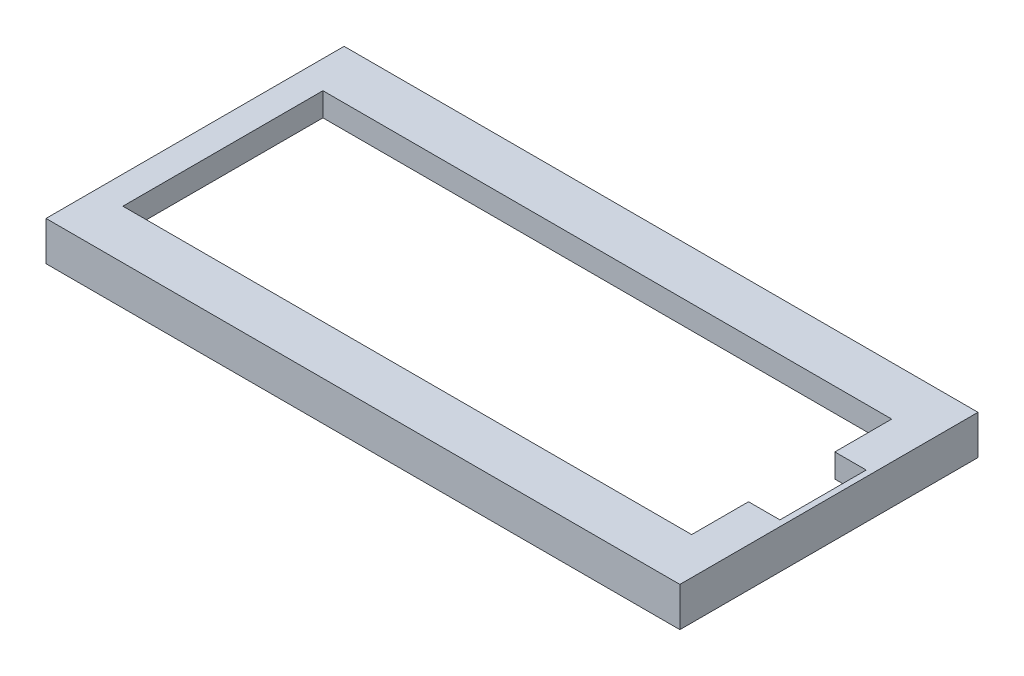
from build123d import *

# Parameters (mm, degrees)
SKETCH1_W           = 82
SKETCH1_H           = 38
MAIN_DEPTH          = 3
SKETCH2_W           = 72.5
SKETCH2_H           = 25.5
LCD_CUTOUT_DEPTH    = 46.287967497
SKETCH3_W           = 41
SKETCH3_H           = 4.75
CONNECTOR_CUT_DEPTH = 1.5
SKETCH4_W           = 9.33307462
SKETCH4_H           = 11
CUT_EXTRUDE3_DEPTH  = 46.287967497
SKETCH6_W           = 82
SKETCH6_H           = 38
BOSS_EXTRUDE2_DEPTH = 2
SKETCH7_W           = 80.5
SKETCH7_H           = 36.5
CUT_EXTRUDE6_DEPTH  = 46.287967497
SKETCH8_W           = 41
SKETCH8_H           = 4.75
CUT_EXTRUDE7_DEPTH  = 46.323834789
SKETCH9_W           = 0.75
SKETCH9_H           = 11
BOSS_EXTRUDE3_DEPTH = 3
SKETCH10_W          = 38
SKETCH10_H          = 5
CUT_EXTRUDE8_DEPTH  = 1.2


with BuildPart() as part:
    # Sketch1 → main (new body)
    with BuildSketch(Plane(origin=(0, 0, 0), x_dir=(1, 0, 0), z_dir=(0, 1, 0))):
        Rectangle(SKETCH1_W, SKETCH1_H)
    extrude(amount=MAIN_DEPTH)

    # Sketch2 → LCD cutout (cut, through all)
    with BuildSketch(Plane(origin=(0, 3, 0), x_dir=(1, 0, 0), z_dir=(0, 1, 0))):
        Rectangle(SKETCH2_W, SKETCH2_H)
    extrude(amount=-LCD_CUTOUT_DEPTH, mode=Mode.SUBTRACT)

    # Sketch3 → connector cut (cut)
    with BuildSketch(Plane.XZ):
        with Locations((-14.5, -16.625)):
            Rectangle(SKETCH3_W, SKETCH3_H)
    extrude(amount=-CONNECTOR_CUT_DEPTH, mode=Mode.SUBTRACT)

    # Sketch4 → Cut-Extrude3 (cut, through all)
    with BuildSketch(Plane(origin=(0, 3, 0), x_dir=(1, 0, 0), z_dir=(0, 1, 0))):
        with Locations((36.888390736, 0)):
            Rectangle(SKETCH4_W, SKETCH4_H)
    extrude(amount=-CUT_EXTRUDE3_DEPTH, mode=Mode.SUBTRACT)

    # Sketch6 → Boss-Extrude2 (add)
    with BuildSketch(Plane(origin=(0, 0, 0), x_dir=(1, 0, 0), z_dir=(0, 1, 0))):
        Rectangle(SKETCH6_W, SKETCH6_H)
    extrude(amount=-BOSS_EXTRUDE2_DEPTH)

    # Sketch7 → Cut-Extrude6 (cut, through all)
    with BuildSketch(Plane(origin=(0, 0, 0), x_dir=(1, 0, 0), z_dir=(0, 1, 0))):
        Rectangle(SKETCH7_W, SKETCH7_H)
    extrude(amount=-CUT_EXTRUDE6_DEPTH, mode=Mode.SUBTRACT)

    # Sketch8 → Cut-Extrude7 (cut, through all)
    with BuildSketch(Plane.XZ.offset(-1.5)):
        with Locations((-14.5, -16.625)):
            Rectangle(SKETCH8_W, SKETCH8_H)
    extrude(amount=CUT_EXTRUDE7_DEPTH, mode=Mode.SUBTRACT)

    # Sketch9 → Boss-Extrude3 (add)
    with BuildSketch(Plane(origin=(0, 0, 0), x_dir=(1, 0, 0), z_dir=(0, 1, 0))):
        with Locations((40.625, 0)):
            Rectangle(SKETCH9_W, SKETCH9_H)
    extrude(amount=BOSS_EXTRUDE3_DEPTH)

    # Sketch10 → Cut-Extrude8 (cut)
    with BuildSketch(Plane.ZY.offset(41)):
        with Locations((0, 0.5)):
            Rectangle(SKETCH10_W, SKETCH10_H)
    extrude(amount=-CUT_EXTRUDE8_DEPTH, mode=Mode.SUBTRACT)


solid = part.part
